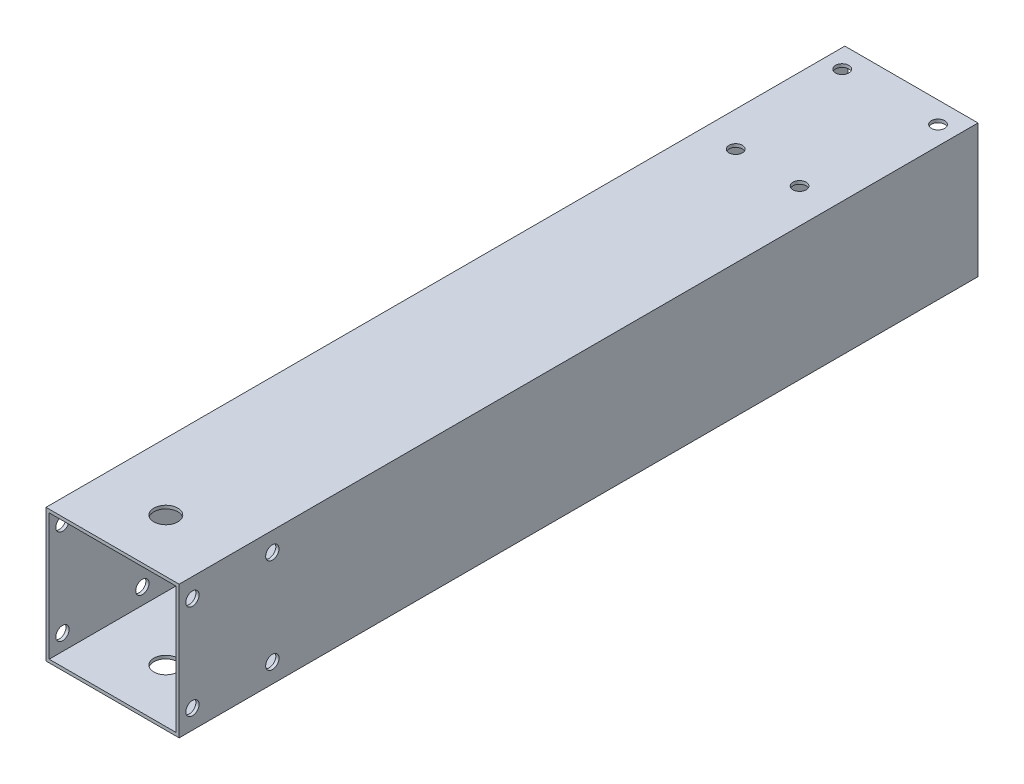
from build123d import *

# Parameters (mm, degrees)
CROQUIS1_W              = 50
CROQUIS1_H              = 50
CROQUIS1_W_2            = 47.6
CROQUIS1_H_2            = 47.6
SALIENTE_EXTRUIR1_DEPTH = 300
CROQUIS2_R              = 2.5
CORTAR_EXTRUIR1_DEPTH   = 306.163890393
CROQUIS3_R              = 4.5
CORTAR_EXTRUIR2_DEPTH   = 306.163890393
CROQUIS4_R              = 8
CORTAR_EXTRUIR3_DEPTH   = 2
CROQUIS5_R              = 2.5
CORTAR_EXTRUIR4_DEPTH   = 306.163890393


with BuildPart() as part:
    # Croquis1 → Saliente-Extruir1 (new body)
    with BuildSketch(Plane.XY):
        Rectangle(CROQUIS1_W, CROQUIS1_H)
        Rectangle(CROQUIS1_W_2, CROQUIS1_H_2, mode=Mode.SUBTRACT)
    extrude(amount=SALIENTE_EXTRUIR1_DEPTH)

    # Croquis2 → Cortar-Extruir1 (cut, through all)
    with BuildSketch(Plane(origin=(25, 0, 0), x_dir=(0, 0, -1), z_dir=(1, 0, 0))):
        with Locations(Location((-295, 17.8, 0), (0, 0, 90))):
            Circle(CROQUIS2_R)
        with Locations(Location((-265, 17.8, 0), (0, 0, 90))):
            Circle(CROQUIS2_R)
        with Locations(Location((-265, -17.8, 0), (0, 0, 90))):
            Circle(CROQUIS2_R)
        with Locations(Location((-295, -17.8, 0), (0, 0, 90))):
            Circle(CROQUIS2_R)
    extrude(amount=-CORTAR_EXTRUIR1_DEPTH, mode=Mode.SUBTRACT)

    # Croquis3 → Cortar-Extruir2 (cut, through all)
    with BuildSketch(Plane(origin=(0, 25, 0), x_dir=(1, 0, 0), z_dir=(0, 1, 0))):
        with Locations(Location((0, -280, 0), (0, 0, 270))):
            Circle(CROQUIS3_R)
    extrude(amount=-CORTAR_EXTRUIR2_DEPTH, mode=Mode.SUBTRACT)

    # Croquis4 → Cortar-Extruir3 (cut)
    with BuildSketch(Plane.XZ.offset(25)):
        with Locations(Location((0, 30, 0), (0, 0, 270))):
            Circle(CROQUIS4_R)
    extrude(amount=-CORTAR_EXTRUIR3_DEPTH, mode=Mode.SUBTRACT)

    # Croquis5 → Cortar-Extruir4 (cut, through all)
    with BuildSketch(Plane.XZ.offset(25)):
        with Locations(Location((-18, 8, 0), (0, 0, 270))):
            Circle(CROQUIS5_R)
        with Locations(Location((-12, 54, 0), (0, 0, 270))):
            Circle(CROQUIS5_R)
        with Locations(Location((18, 8, 0), (0, 0, 90))):
            Circle(CROQUIS5_R)
        with Locations(Location((12, 54, 0), (0, 0, 90))):
            Circle(CROQUIS5_R)
    extrude(amount=-CORTAR_EXTRUIR4_DEPTH, mode=Mode.SUBTRACT)


solid = part.part
